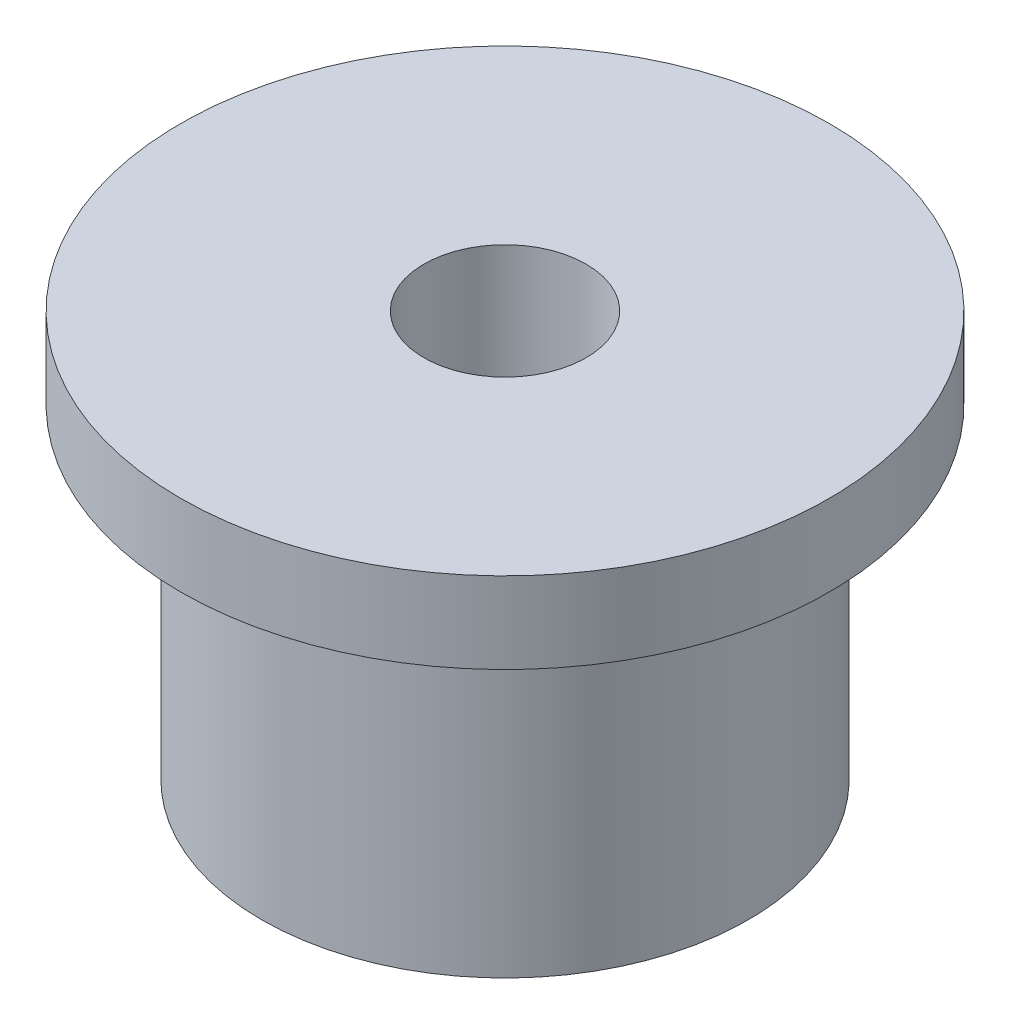
from build123d import *

# Parameters (mm, degrees)
SKETCH1_R               = 100
BOSS_EXTRUDE1_DEPTH     = 25
SKETCH2_R               = 75
BOSS_EXTRUDE2_DEPTH     = 100
CUT_EXTRUDE1_DEPTH      = 189.745860882
CUT_EXTRUDE1_DEPTH_BACK = 189.745860882
SKETCH3_R               = 25


with BuildPart() as part:
    # Sketch1 → Boss-Extrude1 (new body)
    with BuildSketch(Plane(origin=(0, 0, 0), x_dir=(1, 0, 0), z_dir=(0, 1, 0))):
        with Locations(Location((0, 0, 0), (0, 0, 270))):
            Circle(SKETCH1_R)
    extrude(amount=BOSS_EXTRUDE1_DEPTH)

    # Sketch2 → Boss-Extrude2 (add)
    with BuildSketch(Plane.XZ):
        with Locations(Location((0, 0, 0), (0, 0, 270))):
            Circle(SKETCH2_R)
    extrude(amount=BOSS_EXTRUDE2_DEPTH)

    # Sketch3 → Cut-Extrude1 (cut, two sides: drawn at the far end of the back side and taken through both)
    with BuildSketch(Plane.XZ.offset(100).offset(-CUT_EXTRUDE1_DEPTH_BACK)):
        with Locations(Location((0, 0, 0), (0, 0, 270))):
            Circle(SKETCH3_R)
    extrude(amount=CUT_EXTRUDE1_DEPTH + CUT_EXTRUDE1_DEPTH_BACK, mode=Mode.SUBTRACT)


solid = part.part
